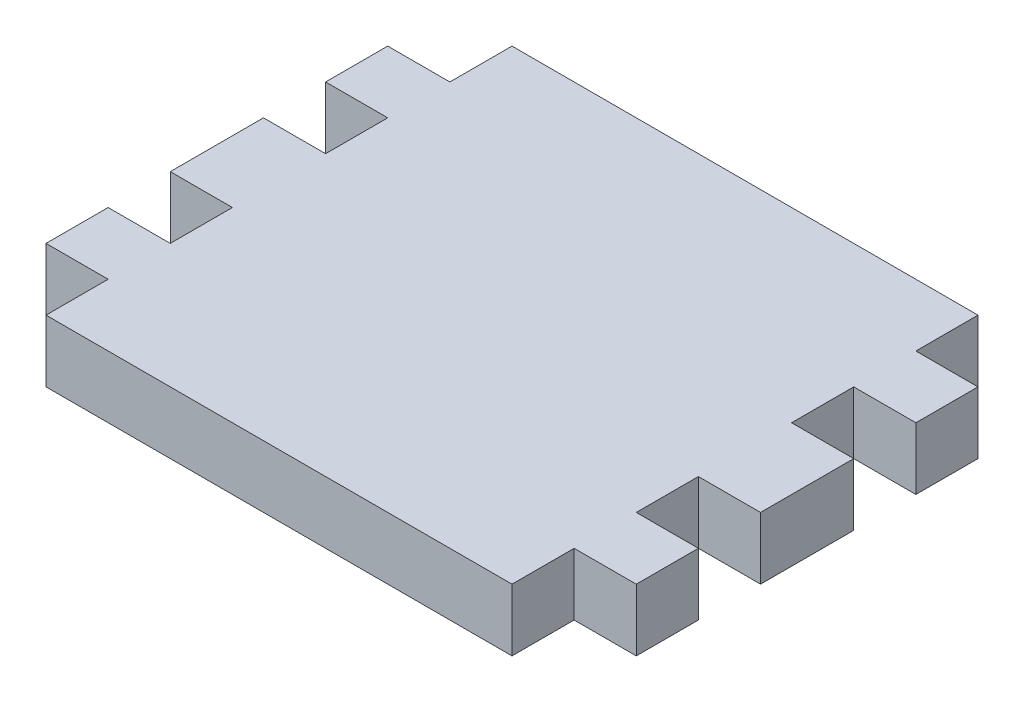
from build123d import *

# Parameters (mm, degrees)
SKETCH1_W           = 48.26
SKETCH1_H           = 38.1
BOSS_EXTRUDE1_DEPTH = 5.08
SKETCH2_W           = 5.08
SKETCH2_H           = 5.08
CUT_EXTRUDE1_DEPTH  = 5.08


with BuildPart() as part:
    # Sketch1 → Boss-Extrude1 (new body)
    with BuildSketch(Plane(origin=(0, 0, 0), x_dir=(1, 0, 0), z_dir=(0, 1, 0))):
        with Locations((6.327422222, -8.003822222)):
            Rectangle(SKETCH1_W, SKETCH1_H)
    extrude(amount=BOSS_EXTRUDE1_DEPTH)

    # Sketch2 → Cut-Extrude1 (cut)
    with BuildSketch(Plane(origin=(0, 5.08, 0), x_dir=(1, 0, 0), z_dir=(0, 1, 0))):
        with Locations((27.917422222, -24.513822222)):
            Rectangle(SKETCH2_W, SKETCH2_H)
        with Locations((27.917422222, -14.353822222)):
            Rectangle(SKETCH2_W, SKETCH2_H)
        with Locations((-15.262577778, 8.506177778)):
            Rectangle(SKETCH2_W, SKETCH2_H)
        with Locations((-15.262577778, -1.653822222)):
            Rectangle(SKETCH2_W, SKETCH2_H)
        with Locations((-15.262577778, -24.513822222)):
            Rectangle(SKETCH2_W, SKETCH2_H)
        with Locations((-15.262577778, -14.353822222)):
            Rectangle(SKETCH2_W, SKETCH2_H)
        with Locations((27.917422222, -1.653822222)):
            Rectangle(SKETCH2_W, SKETCH2_H)
        with Locations((27.917422222, 8.506177778)):
            Rectangle(SKETCH2_W, SKETCH2_H)
    extrude(amount=-CUT_EXTRUDE1_DEPTH, mode=Mode.SUBTRACT)


solid = part.part
